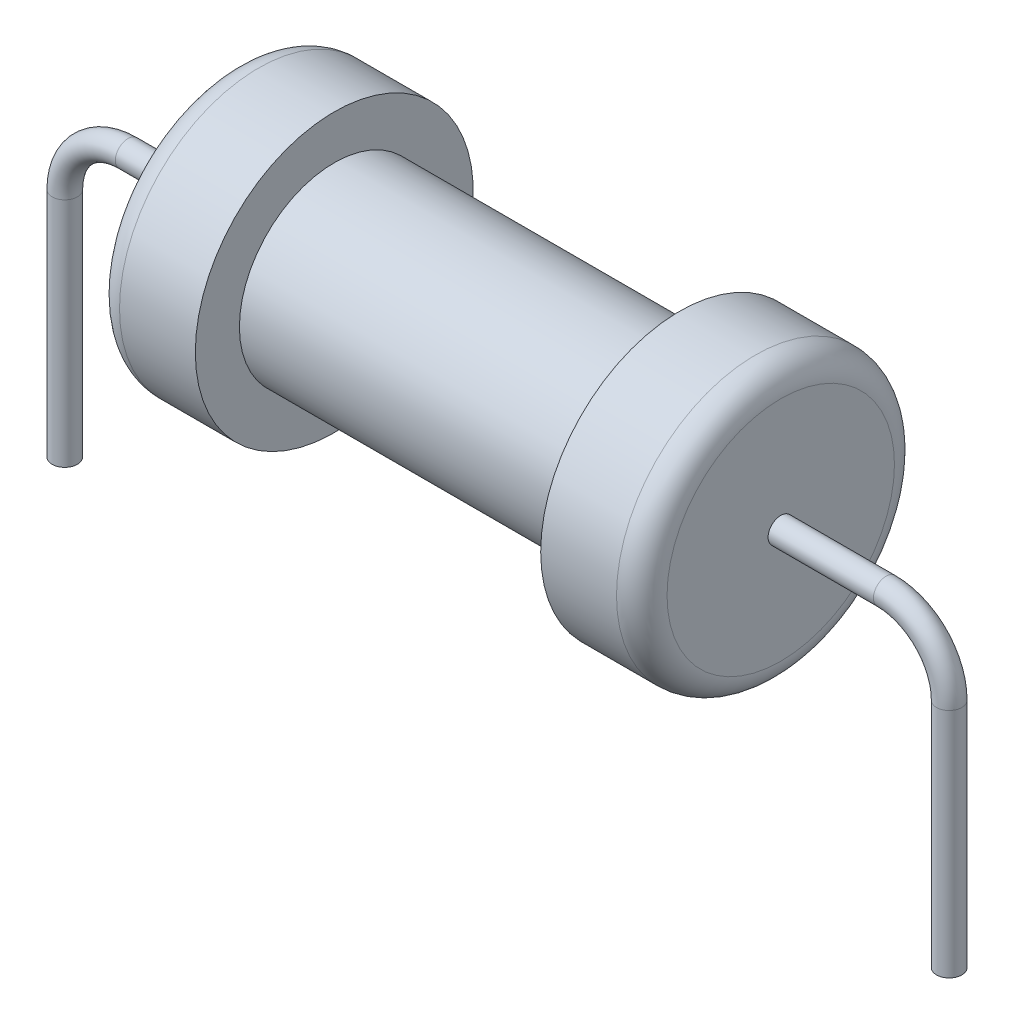
from build123d import *

# Parameters (mm, degrees)
SWEEP1_PROFILE_R = 300
SWEEP2_PROFILE_R = 300
SKETCH1_W        = 8200
SKETCH1_H        = 2253.285346905


with BuildPart() as part:
    # Sweep1: sweep along a path in Sketch4
    with BuildLine(Plane.XY) as sweep1_path:
        Line((10500, -7000), (10500, -1500))
        ThreePointArc((10500, -1500), (10060.66017178, -439.33982822), (9000, 0))
        Line((9000, 0), (6500, 0))
    # Sweep1 profile (on start of the path) → Sweep1 (sweep)
    with BuildSketch(Plane(origin=(10500, -7000, 0), x_dir=(0, 0, 1), z_dir=(0, 1, 0))):
        Circle(SWEEP1_PROFILE_R)
    sweep(path=sweep1_path.line)


with BuildPart() as body_2:
    # Sweep2: sweep along a path in Sketch3
    with BuildLine(Plane.XY) as sweep2_path:
        Line((-6499.25397283, 0), (-8999.25397283, 0))
        ThreePointArc((-8999.25397283, 0), (-10059.91414461, -439.33982822), (-10499.25397283, -1500))
        Line((-10499.25397283, -1500), (-10499.25397283, -7000))
    # Sweep2 profile (on start of the path) → Sweep2 (sweep)
    with BuildSketch(Plane(origin=(-6499.25397283, 0, 0), x_dir=(0, 0, -1), z_dir=(-1, 0, 0))):
        Circle(SWEEP2_PROFILE_R)
    sweep(path=sweep2_path.line)


with BuildPart() as body_3:
    # Sketch1 → Revolve2 (revolve)
    with BuildSketch(Plane(origin=(0, 0, 0), x_dir=(1, 0, 0), z_dir=(0, 1, 0)), mode=Mode.PRIVATE) as revolve2_sk:
        with BuildLine():
            Line((4100, 2253.285346905), (4100, 0))
            Line((4100, 0), (6500, 0))
            Line((6500, 0), (6500, 2700))
            ThreePointArc((6500, 2700), (6324.264068712, 3124.264068712), (5900, 3300))
            Line((5900, 3300), (4100, 3300))
            Line((4100, 3300), (4100, 2253.285346905))
        make_face()
        with Locations((0, 1126.642673453)):
            Rectangle(SKETCH1_W, SKETCH1_H)
        with BuildLine():
            ThreePointArc((-5900, 3300), (-6324.264068712, 3124.264068712), (-6500, 2700))
            Line((-6500, 2700), (-6500, 0))
            Line((-6500, 0), (-4100, 0))
            Line((-4100, 0), (-4100, 2253.285346905))
            Line((-4100, 2253.285346905), (-4100, 3300))
            Line((-4100, 3300), (-5900, 3300))
        make_face()
    revolve(revolve2_sk.sketch.rotate(Axis((-12281.118467832, 0, 0), (1, 0, 0)), 180), axis=Axis((-12281.118467832, 0, 0), (1, 0, 0)))


solid = Compound([part.part, body_2.part, body_3.part])
